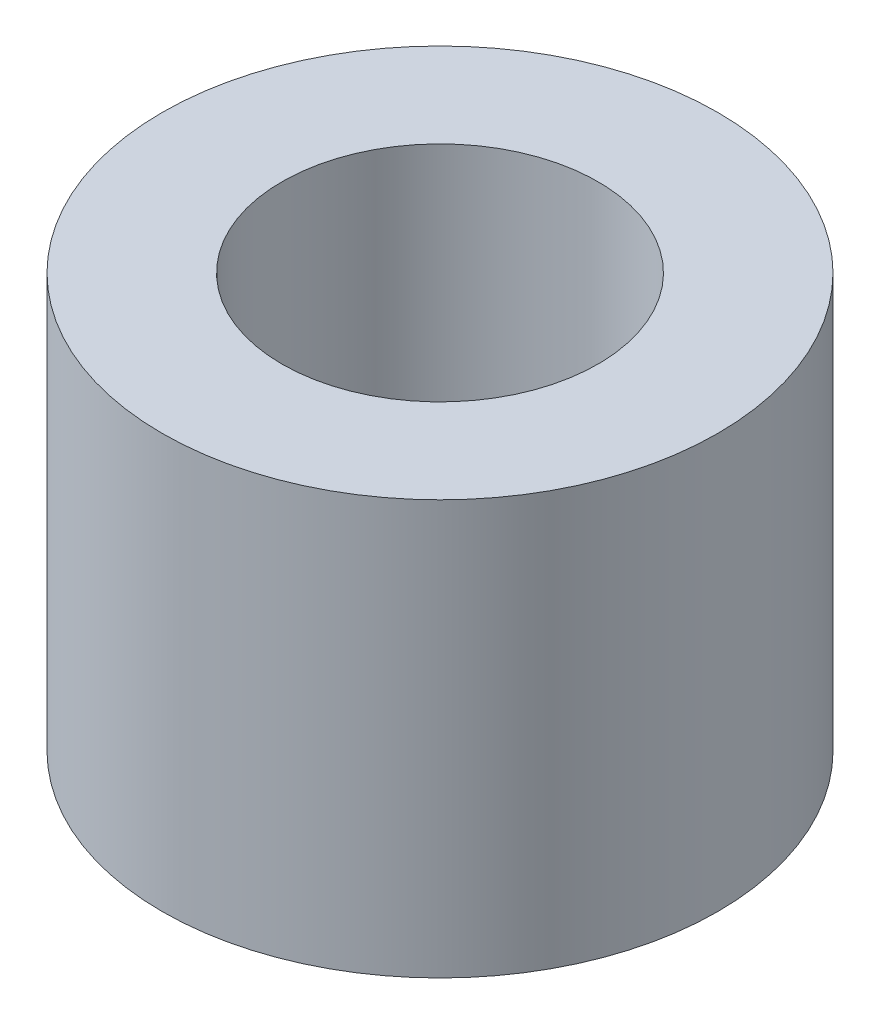
from build123d import *

# Parameters (mm, degrees)
SKETCH1_W = 5.5
SKETCH1_H = 19


with BuildPart() as part:
    # Sketch1 → Revolve3 (revolve)
    with BuildSketch(Plane(origin=(0, 0, 0), x_dir=(0, 0, -1), z_dir=(1, 0, 0))):
        with Locations((-10, 0)):
            Rectangle(SKETCH1_W, SKETCH1_H)
    revolve(axis=Axis((0, 16.806818182, 0), (0, -1, 0)))


solid = part.part
